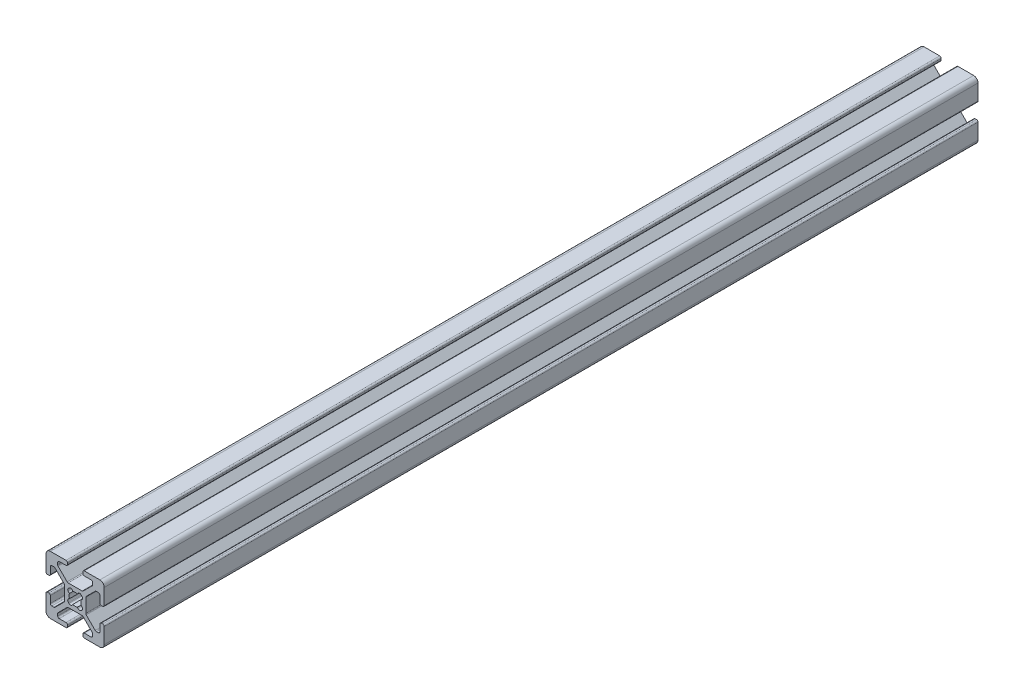
from build123d import *

# Parameters (mm, degrees)
BOSS_EXTRUDE1_DEPTH = 300


with BuildPart() as part:
    # Sketch1 → Boss-Extrude1 (new body)
    with BuildSketch(Plane.XY.offset(4000)):
        with BuildLine():
            Line((10, 3.138), (10, 8.5))
            ThreePointArc((10, 8.5), (9.560660172, 9.560660172), (8.5, 10))
            Line((8.5, 10), (3.138, 10))
            ThreePointArc((3.138, 10), (2.778789755, 9.851210245), (2.63, 9.492))
            Line((2.63, 9.492), (2.63, 9.008))
            ThreePointArc((2.63, 9.008), (2.778789755, 8.648789755), (3.138, 8.5))
            Line((3.138, 8.5), (5.487, 8.5))
            ThreePointArc((5.487, 8.5), (5.846210245, 8.351210245), (5.995, 7.992))
            Line((5.995, 7.992), (5.995, 7.266080661))
            ThreePointArc((5.995, 7.266080661), (5.956330803, 7.071677478), (5.846210245, 6.906870417))
            Line((5.846210245, 6.906870417), (2.743129583, 3.803789755))
            ThreePointArc((2.743129583, 3.803789755), (2.578322522, 3.693669197), (2.383919339, 3.655))
            Line((2.383919339, 3.655), (-2.383919339, 3.655))
            ThreePointArc((-2.383919339, 3.655), (-2.578322522, 3.693669197), (-2.743129583, 3.803789755))
            Line((-2.743129583, 3.803789755), (-5.846210245, 6.906870417))
            ThreePointArc((-5.846210245, 6.906870417), (-5.956330803, 7.071677478), (-5.995, 7.266080661))
            Line((-5.995, 7.266080661), (-5.995, 7.992))
            ThreePointArc((-5.995, 7.992), (-5.846210245, 8.351210245), (-5.487, 8.5))
            Line((-5.487, 8.5), (-3.138, 8.5))
            ThreePointArc((-3.138, 8.5), (-2.778789755, 8.648789755), (-2.63, 9.008))
            Line((-2.63, 9.008), (-2.63, 9.492))
            ThreePointArc((-2.63, 9.492), (-2.778789755, 9.851210245), (-3.138, 10))
            Line((-3.138, 10), (-8.5, 10))
            ThreePointArc((-8.5, 10), (-9.560660172, 9.560660172), (-10, 8.5))
            Line((-10, 8.5), (-10, 3.138))
            ThreePointArc((-10, 3.138), (-9.851210245, 2.778789755), (-9.492, 2.63))
            Line((-9.492, 2.63), (-9.008, 2.63))
            ThreePointArc((-9.008, 2.63), (-8.648789755, 2.778789755), (-8.5, 3.138))
            Line((-8.5, 3.138), (-8.5, 5.487))
            ThreePointArc((-8.5, 5.487), (-8.351210245, 5.846210245), (-7.992, 5.995))
            Line((-7.992, 5.995), (-7.266080661, 5.995))
            ThreePointArc((-7.266080661, 5.995), (-7.071677478, 5.956330803), (-6.906870417, 5.846210245))
            Line((-6.906870417, 5.846210245), (-3.803789755, 2.743129583))
            ThreePointArc((-3.803789755, 2.743129583), (-3.693669197, 2.578322522), (-3.655, 2.383919339))
            Line((-3.655, 2.383919339), (-3.655, -2.383919339))
            ThreePointArc((-3.655, -2.383919339), (-3.693669197, -2.578322522), (-3.803789755, -2.743129583))
            Line((-3.803789755, -2.743129583), (-6.906870417, -5.846210245))
            ThreePointArc((-6.906870417, -5.846210245), (-7.071677478, -5.956330803), (-7.266080661, -5.995))
            Line((-7.266080661, -5.995), (-7.992, -5.995))
            ThreePointArc((-7.992, -5.995), (-8.351210245, -5.846210245), (-8.5, -5.487))
            Line((-8.5, -5.487), (-8.5, -3.138))
            ThreePointArc((-8.5, -3.138), (-8.648789755, -2.778789755), (-9.008, -2.63))
            Line((-9.008, -2.63), (-9.492, -2.63))
            ThreePointArc((-9.492, -2.63), (-9.851210245, -2.778789755), (-10, -3.138))
            Line((-10, -3.138), (-10, -8.5))
            ThreePointArc((-10, -8.5), (-9.560660172, -9.560660172), (-8.5, -10))
            Line((-8.5, -10), (-3.138, -10))
            ThreePointArc((-3.138, -10), (-2.778789755, -9.851210245), (-2.63, -9.492))
            Line((-2.63, -9.492), (-2.63, -9.008))
            ThreePointArc((-2.63, -9.008), (-2.778789755, -8.648789755), (-3.138, -8.5))
            Line((-3.138, -8.5), (-5.487, -8.5))
            ThreePointArc((-5.487, -8.5), (-5.846210245, -8.351210245), (-5.995, -7.992))
            Line((-5.995, -7.992), (-5.995, -7.266080661))
            ThreePointArc((-5.995, -7.266080661), (-5.956330803, -7.071677478), (-5.846210245, -6.906870417))
            Line((-5.846210245, -6.906870417), (-2.743129583, -3.803789755))
            ThreePointArc((-2.743129583, -3.803789755), (-2.578322522, -3.693669197), (-2.383919339, -3.655))
            Line((-2.383919339, -3.655), (2.383919339, -3.655))
            ThreePointArc((2.383919339, -3.655), (2.578322522, -3.693669197), (2.743129583, -3.803789755))
            Line((2.743129583, -3.803789755), (5.846210245, -6.906870417))
            ThreePointArc((5.846210245, -6.906870417), (5.956330803, -7.071677478), (5.995, -7.266080661))
            Line((5.995, -7.266080661), (5.995, -7.992))
            ThreePointArc((5.995, -7.992), (5.846210245, -8.351210245), (5.487, -8.5))
            Line((5.487, -8.5), (3.138, -8.5))
            ThreePointArc((3.138, -8.5), (2.778789755, -8.648789755), (2.63, -9.008))
            Line((2.63, -9.008), (2.63, -9.492))
            ThreePointArc((2.63, -9.492), (2.778789755, -9.851210245), (3.138, -10))
            Line((3.138, -10), (8.5, -10))
            ThreePointArc((8.5, -10), (9.560660172, -9.560660172), (10, -8.5))
            Line((10, -8.5), (10, -3.138))
            ThreePointArc((10, -3.138), (9.851210245, -2.778789755), (9.492, -2.63))
            Line((9.492, -2.63), (9.008, -2.63))
            ThreePointArc((9.008, -2.63), (8.648789755, -2.778789755), (8.5, -3.138))
            Line((8.5, -3.138), (8.5, -5.487))
            ThreePointArc((8.5, -5.487), (8.351210245, -5.846210245), (7.992, -5.995))
            Line((7.992, -5.995), (7.266080661, -5.995))
            ThreePointArc((7.266080661, -5.995), (7.071677478, -5.956330803), (6.906870417, -5.846210245))
            Line((6.906870417, -5.846210245), (3.803789755, -2.743129583))
            ThreePointArc((3.803789755, -2.743129583), (3.693669197, -2.578322522), (3.655, -2.383919339))
            Line((3.655, -2.383919339), (3.655, 2.383919339))
            ThreePointArc((3.655, 2.383919339), (3.693669197, 2.578322522), (3.803789755, 2.743129583))
            Line((3.803789755, 2.743129583), (6.906870417, 5.846210245))
            ThreePointArc((6.906870417, 5.846210245), (7.071677478, 5.956330803), (7.266080661, 5.995))
            Line((7.266080661, 5.995), (7.992, 5.995))
            ThreePointArc((7.992, 5.995), (8.351210245, 5.846210245), (8.5, 5.487))
            Line((8.5, 5.487), (8.5, 3.138))
            ThreePointArc((8.5, 3.138), (8.648789755, 2.778789755), (9.008, 2.63))
            Line((9.008, 2.63), (9.492, 2.63))
            ThreePointArc((9.492, 2.63), (9.851210245, 2.778789755), (10, 3.138))
        make_face()
        with BuildLine():
            Line((-2.124900844, -2.304505966), (-2.304505966, -2.124900844))
            ThreePointArc((-2.304505966, -2.124900844), (-2.505938017, -1.356467811), (-1.935133506, -0.803976718))
            ThreePointArc((-1.935133506, -0.803976718), (-2.0955, 0), (-1.935133506, 0.803976718))
            ThreePointArc((-1.935133506, 0.803976718), (-2.505938017, 1.356467811), (-2.304505966, 2.124900844))
            Line((-2.304505966, 2.124900844), (-2.124900844, 2.304505966))
            ThreePointArc((-2.124900844, 2.304505966), (-1.356467811, 2.505938017), (-0.803976718, 1.935133506))
            ThreePointArc((-0.803976718, 1.935133506), (0, 2.0955), (0.803976718, 1.935133506))
            ThreePointArc((0.803976718, 1.935133506), (1.356467811, 2.505938017), (2.124900844, 2.304505966))
            Line((2.124900844, 2.304505966), (2.304505966, 2.124900844))
            ThreePointArc((2.304505966, 2.124900844), (2.505938017, 1.356467811), (1.935133506, 0.803976718))
            ThreePointArc((1.935133506, 0.803976718), (2.0955, 0), (1.935133506, -0.803976718))
            ThreePointArc((1.935133506, -0.803976718), (2.505938017, -1.356467811), (2.304505966, -2.124900844))
            Line((2.304505966, -2.124900844), (2.124900844, -2.304505966))
            ThreePointArc((2.124900844, -2.304505966), (1.356467811, -2.505938017), (0.803976718, -1.935133506))
            ThreePointArc((0.803976718, -1.935133506), (0, -2.0955), (-0.803976718, -1.935133506))
            ThreePointArc((-0.803976718, -1.935133506), (-1.356467811, -2.505938017), (-2.124900844, -2.304505966))
        make_face(mode=Mode.SUBTRACT)
    extrude(amount=-BOSS_EXTRUDE1_DEPTH)


solid = part.part
